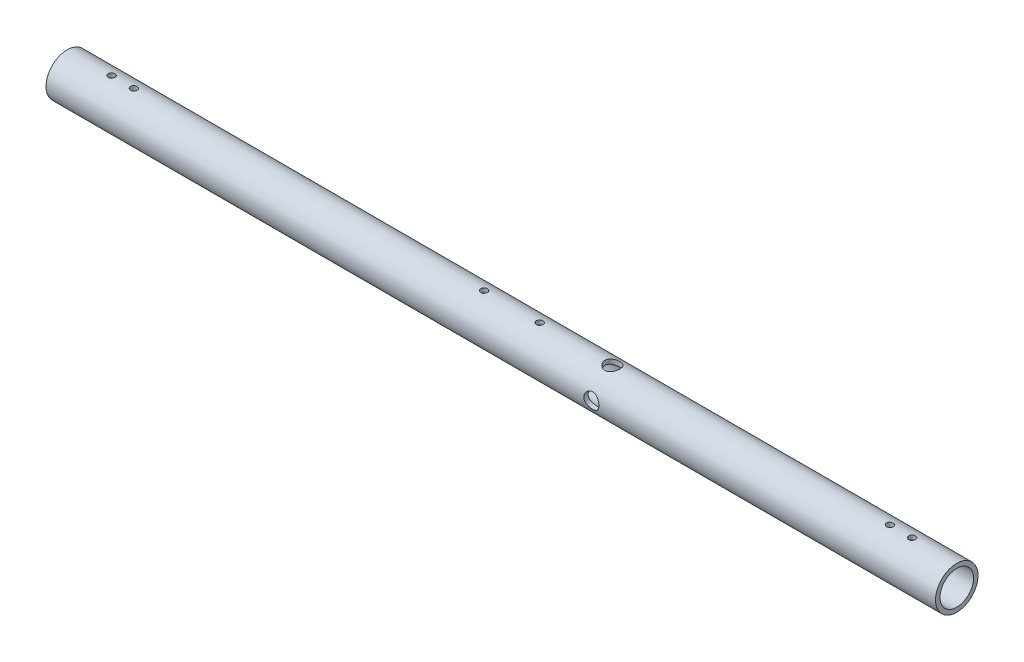
from build123d import *

# Parameters (mm, degrees)
CROQUIS1_W                 = 400
CROQUIS1_H                 = 2
CORTAR_EXTRUIR1_DEPTH      = 201.455493813
CORTAR_EXTRUIR1_DEPTH_BACK = 201.455493813
CROQUIS2_R                 = 1.5
CROQUIS2_R_2               = 3.4
CROQUIS3_R                 = 3.4
CORTAR_EXTRUIR2_DEPTH      = 201.455493924


with BuildPart() as part:
    # Croquis1 → Revolución1 (revolve)
    with BuildSketch(Plane.XY):
        with Locations((0, 8.55)):
            Rectangle(CROQUIS1_W, CROQUIS1_H)
    revolve(axis=Axis((200, 0, 0), (-1, 0, 0)))

    # Croquis2 → Cortar-Extruir1 (cut, two sides: drawn at the far end of the back side and taken through both)
    with BuildSketch(Plane(origin=(0, 0, 0), x_dir=(1, 0, 0), z_dir=(0, 1, 0)).offset(-CORTAR_EXTRUIR1_DEPTH_BACK)):
        with Locations(Location((-180, 0, 0), (0, 0, 270))):
            Circle(CROQUIS2_R)
        with Locations(Location((180, 0, 0), (0, 0, 270))):
            Circle(CROQUIS2_R)
        with Locations(Location((-12.5, 0, 0), (0, 0, 270))):
            Circle(CROQUIS2_R)
        with Locations(Location((12.5, 0, 0), (0, 0, 270))):
            Circle(CROQUIS2_R)
        with Locations(Location((-170, 0, 0), (0, 0, 270))):
            Circle(CROQUIS2_R)
        with Locations(Location((170, 0, 0), (0, 0, 270))):
            Circle(CROQUIS2_R)
        with Locations(Location((45.21, 0, 0), (0, 0, 270))):
            Circle(CROQUIS2_R_2)
    extrude(amount=CORTAR_EXTRUIR1_DEPTH + CORTAR_EXTRUIR1_DEPTH_BACK, mode=Mode.SUBTRACT)

    # Croquis3 → Cortar-Extruir2 (cut, through all)
    with BuildSketch(Plane.XY):
        with Locations(Location((45.21, 0, 0), (0, 0, 180))):
            Circle(CROQUIS3_R)
    extrude(amount=CORTAR_EXTRUIR2_DEPTH, mode=Mode.SUBTRACT)


solid = part.part
